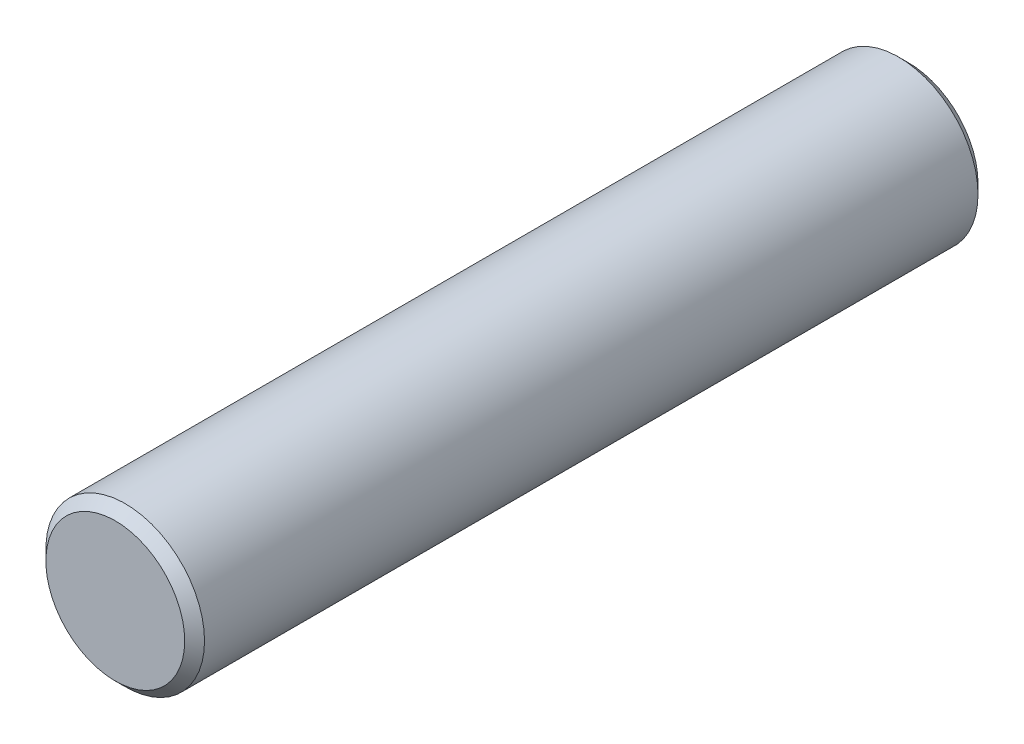
from build123d import *

# Parameters (mm, degrees)
SKETCH1_R           = 2
BOSS_EXTRUDE1_DEPTH = 20
CHAMFER1_SIZE       = 0.25


with BuildPart() as part:
    # Sketch1 → Boss-Extrude1 (new body)
    with BuildSketch(Plane.XY):
        Circle(SKETCH1_R)
    extrude(amount=BOSS_EXTRUDE1_DEPTH)

    # Chamfer1
    chamfer1_edges = [part.edges().sort_by_distance(p)[0] for p in [
        (-2, 0, 0),
        (-2, 0, 20),
    ]]
    chamfer(chamfer1_edges, length=CHAMFER1_SIZE)


solid = part.part
